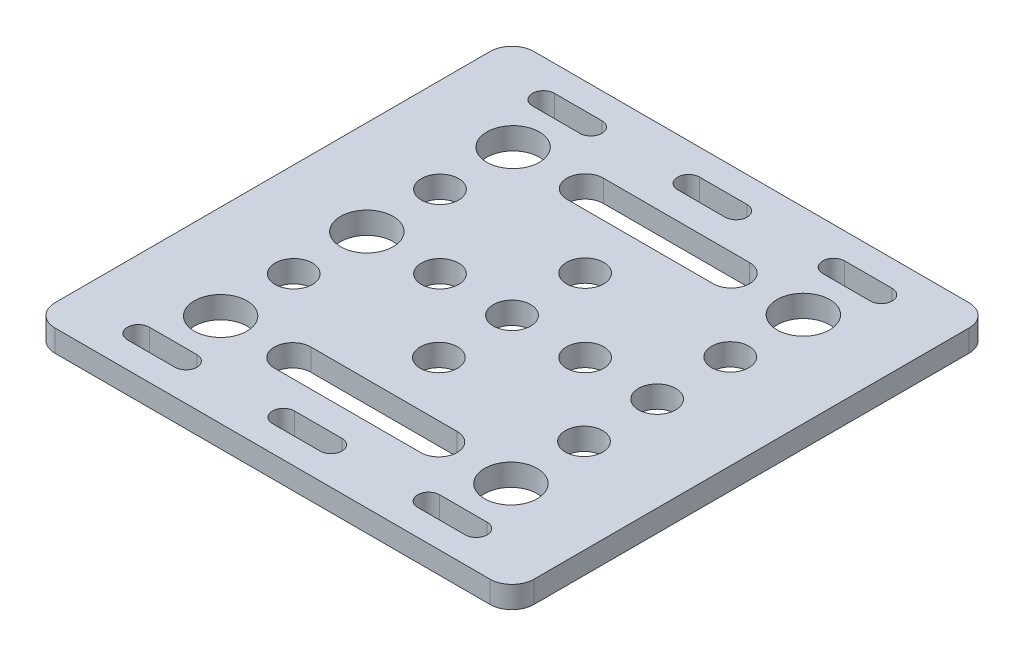
from build123d import *

# Parameters (mm, degrees)
SZKIC1_R                    = 3.6
SZKIC1_R_2                  = 2.55
DODANIE_WYCI_GNI_CIE1_DEPTH = 3


with BuildPart() as part:
    # Szkic1 → Dodanie-wyciągnięcie1 (new body)
    with BuildSketch(Plane(origin=(0, 0, 0), x_dir=(1, 0, 0), z_dir=(0, 1, 0))):
        with BuildLine():
            Line((3, 0), (62.5, 0))
            ThreePointArc((62.5, 0), (64.621320344, 0.878679656), (65.5, 3))
            Line((65.5, 3), (65.5, 62.5))
            ThreePointArc((65.5, 62.5), (64.621320344, 64.621320344), (62.5, 65.5))
            Line((62.5, 65.5), (3, 65.5))
            ThreePointArc((3, 65.5), (0.878679656, 64.621320344), (0, 62.5))
            Line((0, 62.5), (0, 3))
            ThreePointArc((0, 3), (0.878679656, 0.878679656), (3, 0))
        make_face()
        with Locations(Location((12.9, 52.75, 0), (0, 0, 270))):
            Circle(SZKIC1_R, mode=Mode.SUBTRACT)
        with Locations(Location((52.6, 52.75, 0), (0, 0, 270))):
            Circle(SZKIC1_R, mode=Mode.SUBTRACT)
        with Locations(Location((52.6, 12.75, 0), (0, 0, 270))):
            Circle(SZKIC1_R, mode=Mode.SUBTRACT)
        with Locations(Location((12.9, 32.75, 0), (0, 0, 270))):
            Circle(SZKIC1_R, mode=Mode.SUBTRACT)
        with Locations(Location((12.9, 12.75, 0), (0, 0, 270))):
            Circle(SZKIC1_R, mode=Mode.SUBTRACT)
        with Locations(Location((12.9, 42.75, 0), (0, 0, 270))):
            Circle(SZKIC1_R_2, mode=Mode.SUBTRACT)
        with Locations(Location((32.75, 42.75, 0), (0, 0, 270))):
            Circle(SZKIC1_R_2, mode=Mode.SUBTRACT)
        with Locations(Location((52.6, 42.75, 0), (0, 0, 270))):
            Circle(SZKIC1_R_2, mode=Mode.SUBTRACT)
        with Locations(Location((32.75, 32.75, 0), (0, 0, 270))):
            Circle(SZKIC1_R_2, mode=Mode.SUBTRACT)
        with Locations(Location((52.6, 32.75, 0), (0, 0, 270))):
            Circle(SZKIC1_R_2, mode=Mode.SUBTRACT)
        with Locations(Location((32.75, 22.75, 0), (0, 0, 270))):
            Circle(SZKIC1_R_2, mode=Mode.SUBTRACT)
        with Locations(Location((52.6, 22.75, 0), (0, 0, 270))):
            Circle(SZKIC1_R_2, mode=Mode.SUBTRACT)
        with Locations(Location((12.9, 22.75, 0), (0, 0, 270))):
            Circle(SZKIC1_R_2, mode=Mode.SUBTRACT)
        with Locations(Location((42.75, 32.75, 0), (0, 0, 270))):
            Circle(SZKIC1_R_2, mode=Mode.SUBTRACT)
        with Locations(Location((22.9, 32.75, 0), (0, 0, 270))):
            Circle(SZKIC1_R_2, mode=Mode.SUBTRACT)
        with BuildLine():
            Line((9.35, 61.95), (15.85, 61.95))
            ThreePointArc((15.85, 61.95), (17.35, 60.45), (15.85, 58.95))
            Line((15.85, 58.95), (9.35, 58.95))
            ThreePointArc((9.35, 58.95), (7.85, 60.45), (9.35, 61.95))
        make_face(mode=Mode.SUBTRACT)
        with BuildLine():
            Line((29.2, 58.95), (35.7, 58.95))
            ThreePointArc((35.7, 58.95), (37.2, 60.45), (35.7, 61.95))
            Line((35.7, 61.95), (29.2, 61.95))
            ThreePointArc((29.2, 61.95), (27.7, 60.45), (29.2, 58.95))
        make_face(mode=Mode.SUBTRACT)
        with BuildLine():
            Line((49.05, 58.95), (55.55, 58.95))
            ThreePointArc((55.55, 58.95), (57.05, 60.45), (55.55, 61.95))
            Line((55.55, 61.95), (49.05, 61.95))
            ThreePointArc((49.05, 61.95), (47.55, 60.45), (49.05, 58.95))
        make_face(mode=Mode.SUBTRACT)
        with BuildLine():
            Line((29.2, 3.55), (35.7, 3.55))
            ThreePointArc((35.7, 3.55), (37.2, 5.05), (35.7, 6.55))
            Line((35.7, 6.55), (29.2, 6.55))
            ThreePointArc((29.2, 6.55), (27.7, 5.05), (29.2, 3.55))
        make_face(mode=Mode.SUBTRACT)
        with BuildLine():
            Line((49.05, 3.55), (55.55, 3.55))
            ThreePointArc((55.55, 3.55), (57.05, 5.05), (55.55, 6.55))
            Line((55.55, 6.55), (49.05, 6.55))
            ThreePointArc((49.05, 6.55), (47.55, 5.05), (49.05, 3.55))
        make_face(mode=Mode.SUBTRACT)
        with BuildLine():
            Line((9.35, 3.55), (15.85, 3.55))
            ThreePointArc((15.85, 3.55), (17.35, 5.05), (15.85, 6.55))
            Line((15.85, 6.55), (9.35, 6.55))
            ThreePointArc((9.35, 6.55), (7.85, 5.05), (9.35, 3.55))
        make_face(mode=Mode.SUBTRACT)
        with BuildLine():
            Line((22.75, 15.25), (42.75, 15.25))
            ThreePointArc((42.75, 15.25), (45.25, 12.75), (42.75, 10.25))
            Line((42.75, 10.25), (22.75, 10.25))
            ThreePointArc((22.75, 10.25), (20.25, 12.75), (22.75, 15.25))
        make_face(mode=Mode.SUBTRACT)
        with BuildLine():
            Line((22.75, 50.25), (42.75, 50.25))
            ThreePointArc((42.75, 50.25), (45.25, 52.75), (42.75, 55.25))
            Line((42.75, 55.25), (22.75, 55.25))
            ThreePointArc((22.75, 55.25), (20.25, 52.75), (22.75, 50.25))
        make_face(mode=Mode.SUBTRACT)
    extrude(amount=DODANIE_WYCI_GNI_CIE1_DEPTH)


solid = part.part
